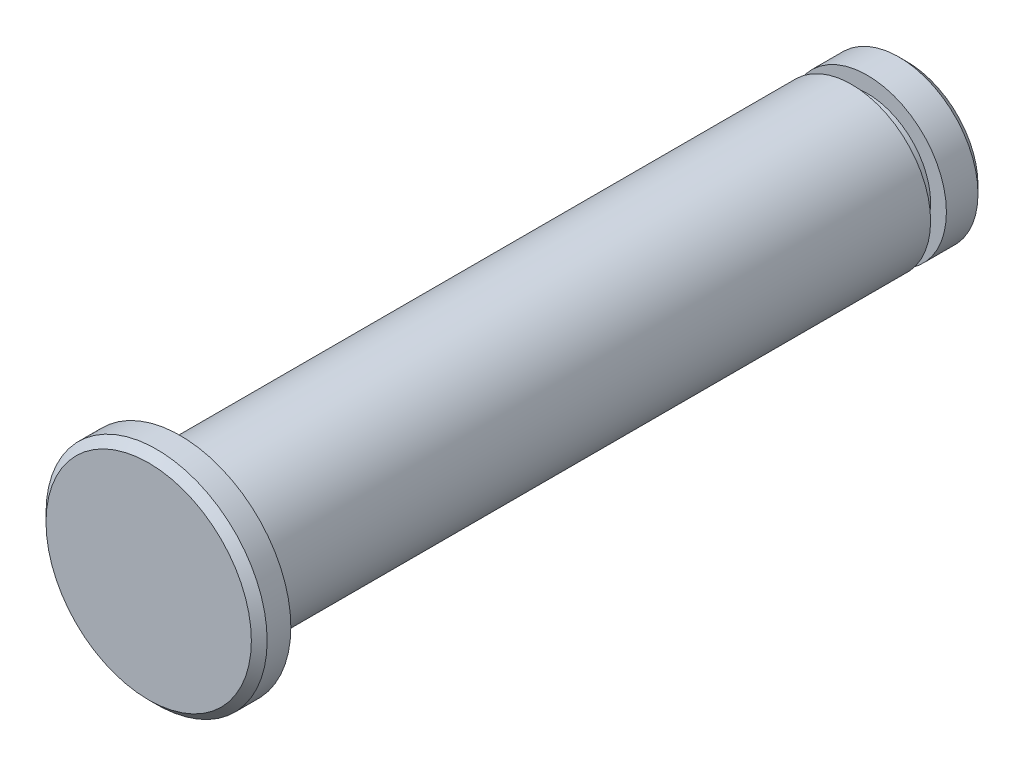
from build123d import *

# Parameters (mm, degrees)
SKETCH_1_R          = 5
EXTRUDE_1_DEPTH     = 46
SKETCH_2_R          = 7
EXTRUDE_2_DEPTH     = 2
CHAMFER_1_SIZE      = 0.5
CUT_EXTRUDE_START   = 2.5
SKETCH_3_R          = 14
SKETCH_3_R_2        = 4
CUT_EXTRUDE_1_DEPTH = 1


with BuildPart() as part:
    # 草图1 → 凸台-拉伸1 (new body)
    with BuildSketch(Plane.XY):
        Circle(SKETCH_1_R)
    extrude(amount=EXTRUDE_1_DEPTH)

    # 草图2 → 凸台-拉伸2 (add)
    with BuildSketch(Plane.XY.offset(46)):
        Circle(SKETCH_2_R)
    extrude(amount=EXTRUDE_2_DEPTH)

    # 倒角1
    chamfer_1_edges = [part.edges().sort_by_distance(p)[0] for p in [
        (-5, 0, 0),
        (-7, 0, 48),
    ]]
    chamfer(chamfer_1_edges, length=CHAMFER_1_SIZE)

    # 草图3 → 切除-拉伸-薄壁1 (cut)
    with BuildSketch(Plane.XY.offset(CUT_EXTRUDE_START)):
        Circle(SKETCH_3_R)
        Circle(SKETCH_3_R_2, mode=Mode.SUBTRACT)
    extrude(amount=CUT_EXTRUDE_1_DEPTH, mode=Mode.SUBTRACT)


solid = part.part
